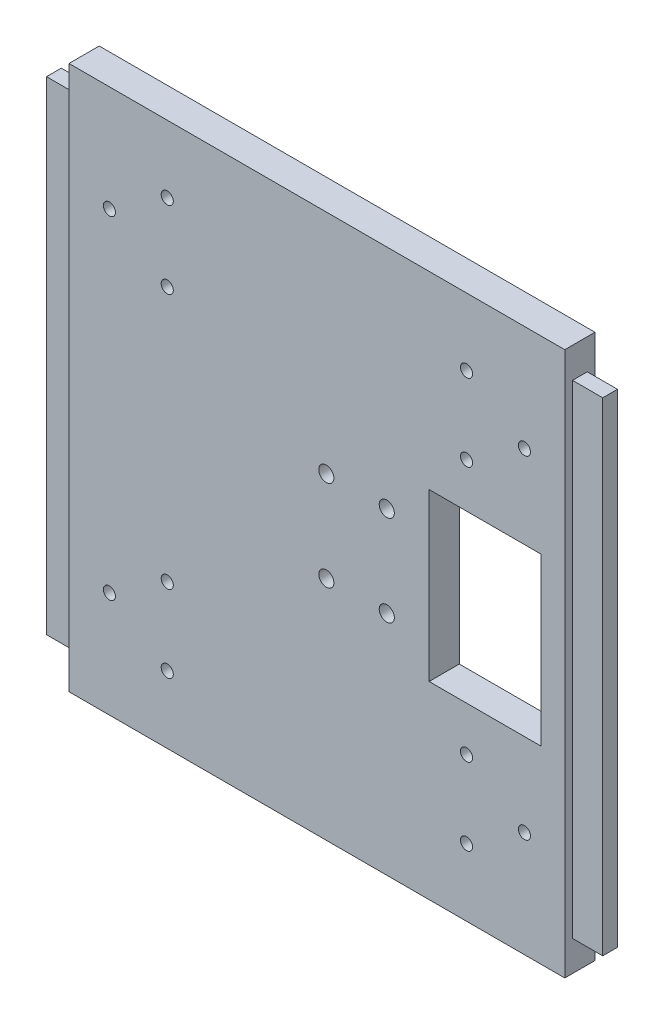
from build123d import *

# Parameters (mm, degrees)
SKETCH_1_W          = 164
SKETCH_1_H          = 180
EXTRUDE_1_DEPTH     = 10
SKETCH_2_W          = 4.88
SKETCH_2_H          = 159.88
EXTRUDE_2_DEPTH     = 10
SKETCH_3_R          = 2
CUT_EXTRUDE_1_DEPTH = 10
SKETCH_5_R          = 2.5
SKETCH_5_W          = 37
SKETCH_5_H          = 55
CUT_EXTRUDE_3_DEPTH = 8
SKETCH_6_W          = 37
SKETCH_6_H          = 55
CUT_EXTRUDE_4_DEPTH = 8


with BuildPart() as part:
    # 草图1 → 凸台-拉伸1 (new body)
    with BuildSketch(Plane.XY):
        with Locations((82, 90)):
            Rectangle(SKETCH_1_W, SKETCH_1_H)
    extrude(amount=EXTRUDE_1_DEPTH)

    # 草图2 → 凸台-拉伸2 (add)
    with BuildSketch(Plane.ZY):
        with Locations((5, 90)):
            Rectangle(SKETCH_2_W, SKETCH_2_H)
    extrude_2 = extrude(amount=EXTRUDE_2_DEPTH)

    # 镜向1: 凸台-拉伸2 across plane
    add(extrude_2.mirror(Plane(origin=(82, 0, 0), x_dir=(0, 0, 1), z_dir=(1, 0, 0))))

    # 草图3 → 切除-拉伸1 (cut)
    with BuildSketch(Plane(origin=(0, 0, 0), x_dir=(-1, 0, 0), z_dir=(0, 0, -1))):
        with Locations((-150.6425573, 145)):
            Circle(SKETCH_3_R)
        with Locations((-131.5, 157.75)):
            Circle(SKETCH_3_R)
        with Locations((-131.5, 132.25)):
            Circle(SKETCH_3_R)
        with Locations((-13.3574427, 145)):
            Circle(SKETCH_3_R)
        with Locations((-32.5, 157.75)):
            Circle(SKETCH_3_R)
        with Locations((-32.5, 132.25)):
            Circle(SKETCH_3_R)
        with Locations(Location((-131.5, 47.75, 0), (0, 0, 180))):
            Circle(SKETCH_3_R)
        with Locations(Location((-131.5, 22.25, 0), (0, 0, 180))):
            Circle(SKETCH_3_R)
        with Locations(Location((-150.6425573, 35, 0), (0, 0, 180))):
            Circle(SKETCH_3_R)
        with Locations(Location((-32.5, 47.75, 0), (0, 0, 180))):
            Circle(SKETCH_3_R)
        with Locations(Location((-32.5, 22.25, 0), (0, 0, 180))):
            Circle(SKETCH_3_R)
        with Locations(Location((-13.3574427, 35, 0), (0, 0, 180))):
            Circle(SKETCH_3_R)
    extrude(amount=-CUT_EXTRUDE_1_DEPTH, mode=Mode.SUBTRACT)

    # 草图5 → 切除-拉伸3 (cut)
    with BuildSketch(Plane.XY.offset(10)):
        with Locations((85.117863175, 105)):
            Circle(SKETCH_5_R)
        with Locations((85.117863175, 75)):
            Circle(SKETCH_5_R)
        with Locations((105.117863175, 105)):
            Circle(SKETCH_5_R)
        with Locations((105.117863175, 75)):
            Circle(SKETCH_5_R)
        with Locations((137.617863175, 90)):
            Rectangle(SKETCH_5_W, SKETCH_5_H)
    extrude(amount=-CUT_EXTRUDE_3_DEPTH, mode=Mode.SUBTRACT)

    # 草图6 → 切除-拉伸4 (cut)
    with BuildSketch(Plane.XY.offset(2)):
        with Locations((137.617863175, 90)):
            Rectangle(SKETCH_6_W, SKETCH_6_H)
    extrude(amount=-CUT_EXTRUDE_4_DEPTH, mode=Mode.SUBTRACT)


solid = part.part
